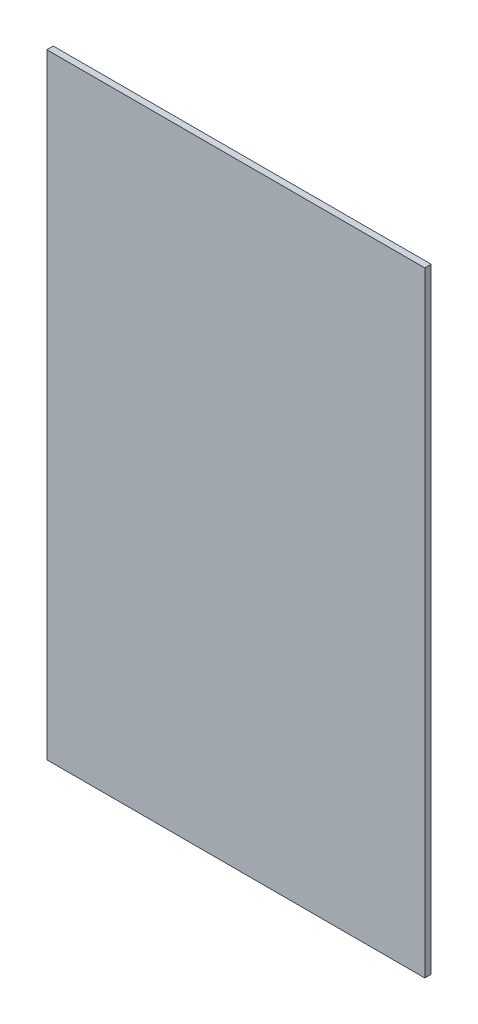
from build123d import *

# Parameters (mm, degrees)
SKETCH1_W           = 187.325
SKETCH1_H           = 304.8
BOSS_EXTRUDE1_DEPTH = 3.175


with BuildPart() as part:
    # Sketch1 → Boss-Extrude1 (new body)
    with BuildSketch(Plane.XY):
        Rectangle(SKETCH1_W, SKETCH1_H)
    extrude(amount=BOSS_EXTRUDE1_DEPTH)


solid = part.part
